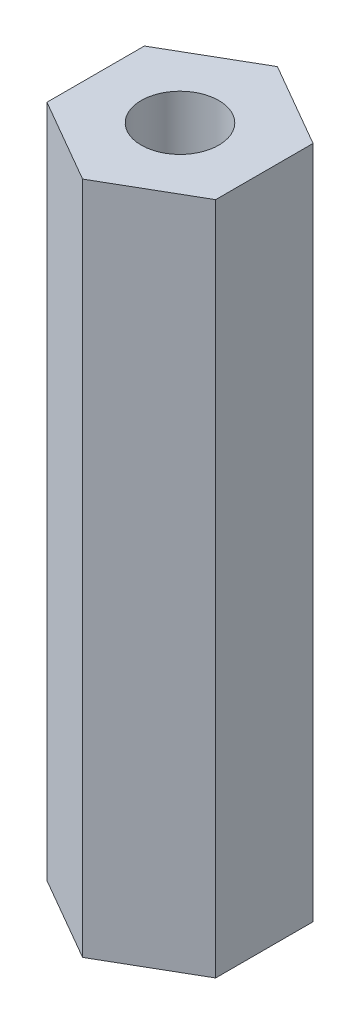
from build123d import *

# Parameters (mm, degrees)
SKETCH1_R           = 1.4605
BOSS_EXTRUDE1_DEPTH = 25.4


with BuildPart() as part:
    # Sketch1 → Boss-Extrude1 (new body)
    with BuildSketch(Plane(origin=(0, 0, 0), x_dir=(1, 0, 0), z_dir=(0, 1, 0))):
        Polygon((-3.17857304, 1.83515), (0, 3.6703), (3.17857304, 1.83515), (3.17857304, -1.83515), (0, -3.6703), (-3.17857304, -1.83515), align=None)
        with Locations(Location((0, 0, 0), (0, 0, 270))):
            Circle(SKETCH1_R, mode=Mode.SUBTRACT)
    extrude(amount=BOSS_EXTRUDE1_DEPTH)


solid = part.part
